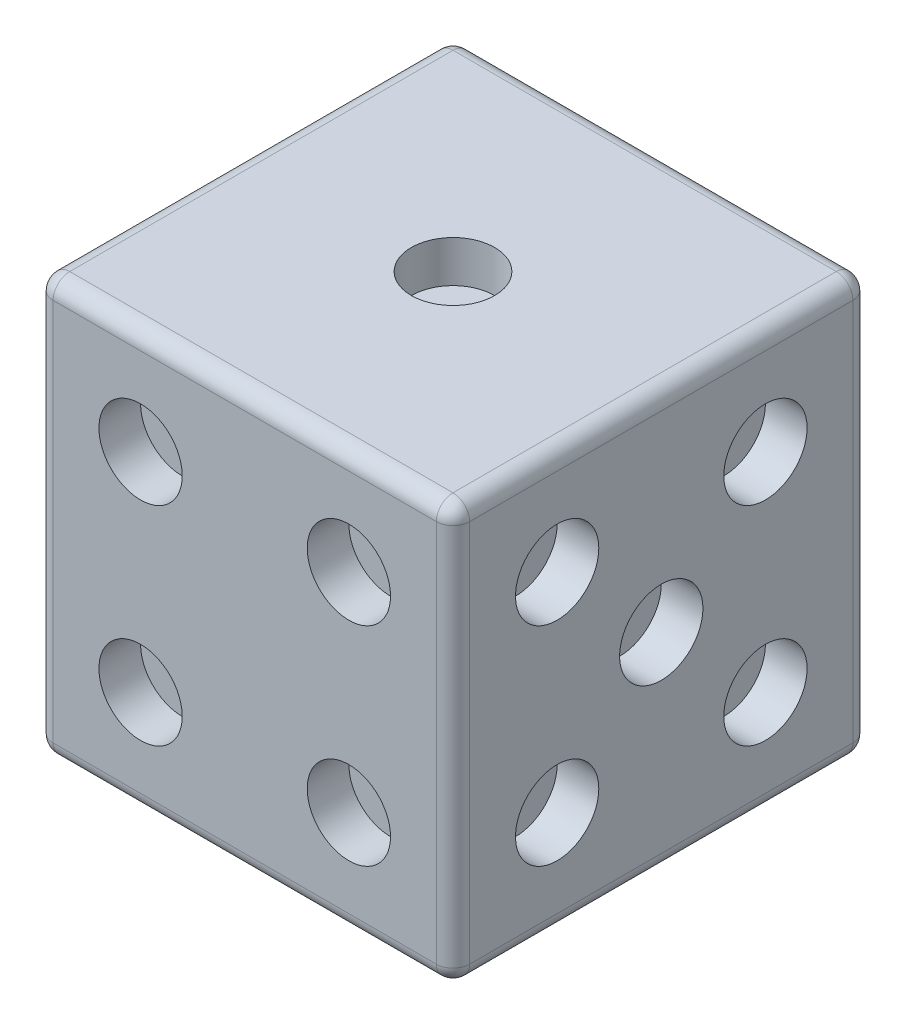
from build123d import *

# Parameters (mm, degrees)
CROQUIS1_W              = 100
CROQUIS1_H              = 100
SALIENTE_EXTRUIR1_DEPTH = 100
CROQUIS8_R              = 10
CORTAR_EXTRUIR7_DEPTH   = 10
CORTAR_EXTRUIR9_START   = -10
CROQUIS10_R             = 10
CORTAR_EXTRUIR9_DEPTH   = 10
CROQUIS11_R             = 10
CORTAR_EXTRUIR11_DEPTH  = 10
CORTAR_EXTRUIR12_START  = -10
CROQUIS9_R              = 10
CORTAR_EXTRUIR12_DEPTH  = 10
CROQUIS12_R             = 10
CORTAR_EXTRUIR13_DEPTH  = 10
CORTAR_EXTRUIR14_START  = -10
CROQUIS13_R             = 10
CORTAR_EXTRUIR14_DEPTH  = 10
REDONDEO2_R             = 4
REDONDEO3_R             = 4


with BuildPart() as part:
    # Croquis1 → Saliente-Extruir1 (new body)
    with BuildSketch(Plane.XY):
        Rectangle(CROQUIS1_W, CROQUIS1_H)
    extrude(amount=SALIENTE_EXTRUIR1_DEPTH)

    # Croquis8 → Cortar-Extruir7 (cut)
    with BuildSketch(Plane(origin=(0, 50, 0), x_dir=(1, 0, 0), z_dir=(0, 1, 0))):
        with Locations(Location((0, -50, 0), (0, 0, 270))):
            Circle(CROQUIS8_R)
    extrude(amount=-CORTAR_EXTRUIR7_DEPTH, mode=Mode.SUBTRACT)

    # Croquis10 → Cortar-Extruir9 (cut)
    with BuildSketch(Plane.XZ.offset(50).offset(CORTAR_EXTRUIR9_START)):
        with Locations(Location((-25, 75, 0), (0, 0, 270))):
            Circle(CROQUIS10_R)
        with Locations(Location((0, 50, 0), (0, 0, 90))):
            Circle(CROQUIS10_R)
        with Locations(Location((25, 25, 0), (0, 0, 270))):
            Circle(CROQUIS10_R)
    extrude(amount=CORTAR_EXTRUIR9_DEPTH, mode=Mode.SUBTRACT)

    # Croquis11 → Cortar-Extruir11 (cut)
    with BuildSketch(Plane(origin=(0, 0, 0), x_dir=(-1, 0, 0), z_dir=(0, 0, -1))):
        with Locations((-25, -25)):
            Circle(CROQUIS11_R)
        with Locations((25, 25)):
            Circle(CROQUIS11_R)
    extrude(amount=-CORTAR_EXTRUIR11_DEPTH, mode=Mode.SUBTRACT)

    # Croquis9 → Cortar-Extruir12 (cut)
    with BuildSketch(Plane.XY.offset(100).offset(CORTAR_EXTRUIR12_START)):
        with Locations(Location((-25, 25, 0), (0, 0, 180))):
            Circle(CROQUIS9_R)
        with Locations(Location((25, -25, 0), (0, 0, 180))):
            Circle(CROQUIS9_R)
        with Locations((25, 25)):
            Circle(CROQUIS9_R)
        with Locations((-25, -25)):
            Circle(CROQUIS9_R)
    extrude(amount=CORTAR_EXTRUIR12_DEPTH, mode=Mode.SUBTRACT)

    # Croquis12 → Cortar-Extruir13 (cut)
    with BuildSketch(Plane(origin=(50, 0, 0), x_dir=(0, 0, -1), z_dir=(1, 0, 0))):
        with Locations((-25, -25)):
            Circle(CROQUIS12_R)
        with Locations((-50, 0)):
            Circle(CROQUIS12_R)
        with Locations((-75, -25)):
            Circle(CROQUIS12_R)
        with Locations((-75, 25)):
            Circle(CROQUIS12_R)
        with Locations((-25, 25)):
            Circle(CROQUIS12_R)
    extrude(amount=-CORTAR_EXTRUIR13_DEPTH, mode=Mode.SUBTRACT)

    # Croquis13 → Cortar-Extruir14 (cut)
    with BuildSketch(Plane.ZY.offset(50).offset(CORTAR_EXTRUIR14_START)):
        with Locations(Location((25, 25, 0), (0, 0, 180))):
            Circle(CROQUIS13_R)
        with Locations((25, 0)):
            Circle(CROQUIS13_R)
        with Locations(Location((25, -25, 0), (0, 0, 180))):
            Circle(CROQUIS13_R)
        with Locations((74.939373622, 25)):
            Circle(CROQUIS13_R)
        with Locations((74.939373622, 0)):
            Circle(CROQUIS13_R)
        with Locations((74.939373622, -25)):
            Circle(CROQUIS13_R)
    extrude(amount=CORTAR_EXTRUIR14_DEPTH, mode=Mode.SUBTRACT)

    # Redondeo2
    redondeo2_edges = [part.edges().sort_by_distance(p)[0] for p in [
        (0, -50, 100),
        (50, 0, 100),
        (50, -50, 50),
    ]]
    fillet(redondeo2_edges, radius=REDONDEO2_R)

    # Redondeo3
    redondeo3_edges = [part.edges().sort_by_distance(p)[0] for p in [
        (-50, -48.828427125, 98.828427125),
        (48.828427125, 50, 98.828427125),
        (-50, 2, 100),
        (-2, -50, 0),
        (-50, 0, 0),
        (0, 50, 0),
        (-50, 50, 50),
        (50, 2, 0),
        (50, 50, 48),
        (48.828427125, -48.828427125, 0),
        (-50, -50, 48),
        (-2, 50, 100),
    ]]
    fillet(redondeo3_edges, radius=REDONDEO3_R)


solid = part.part
